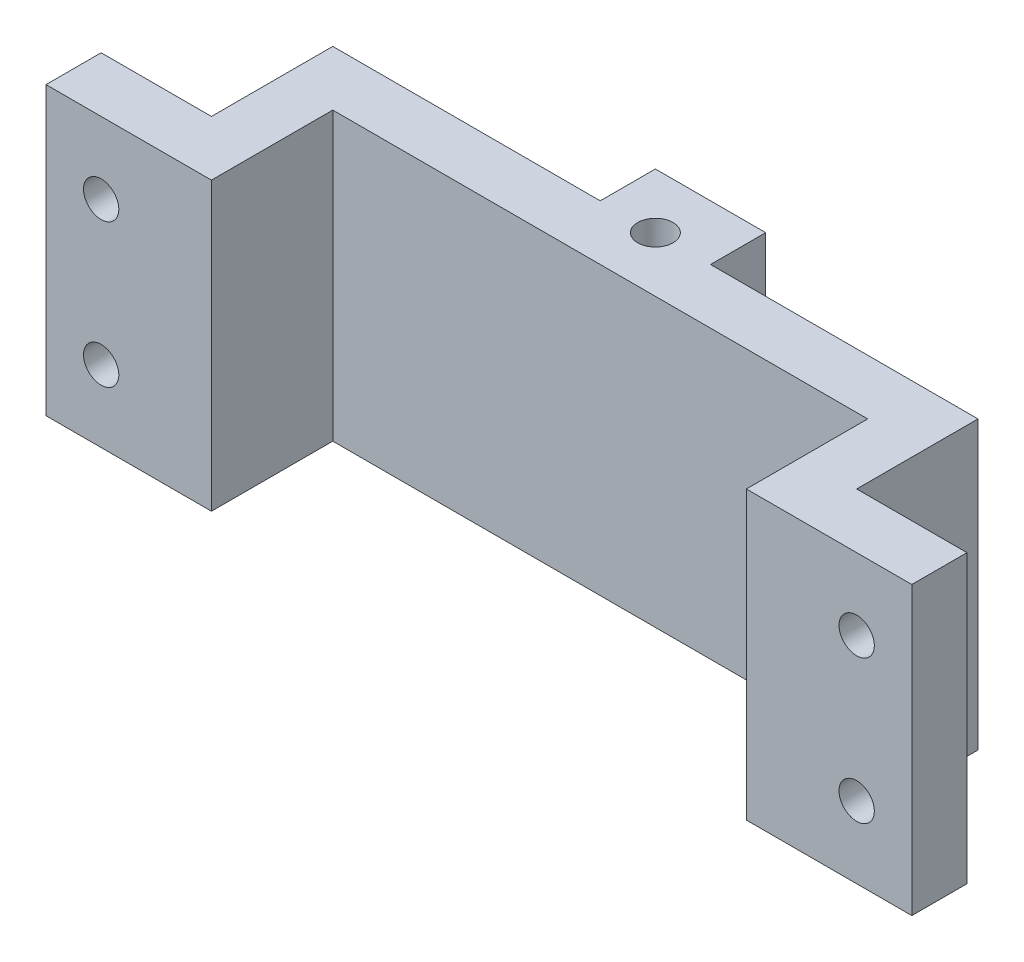
from build123d import *

# Parameters (mm, degrees)
BOSS_EXTRUDE2_DEPTH = 26
SKETCH5_R           = 1.6
CUT_EXTRUDE4_DEPTH  = 26
SKETCH6_R           = 1.6
CUT_EXTRUDE6_DEPTH  = 26


with BuildPart() as part:
    # Sketch1 → Boss-Extrude2 (new body)
    with BuildSketch(Plane(origin=(0, 0, 0), x_dir=(1, 0, 0), z_dir=(0, 1, 0))):
        Polygon((-24.25, 0), (24.25, 0), (24.25, -11), (39.25, -11), (39.25, -6), (29.25, -6), (29.25, 5), (5, 5), (5, 10), (-5, 10), (-5, 5), (-29.25, 5), (-29.25, -6), (-39.25, -6), (-39.25, -11), (-24.25, -11), align=None)
    extrude(amount=BOSS_EXTRUDE2_DEPTH)

    # Sketch5 → Cut-Extrude4 (cut)
    with BuildSketch(Plane.XZ):
        with Locations(Location((0, -5, 0), (0, 0, 270))):
            Circle(SKETCH5_R)
    extrude(amount=-CUT_EXTRUDE4_DEPTH, mode=Mode.SUBTRACT)

    # Sketch6 → Cut-Extrude6 (cut)
    with BuildSketch(Plane(origin=(0, 0, 6), x_dir=(-1, 0, 0), z_dir=(0, 0, -1))):
        with Locations((34.25, 19.5)):
            Circle(SKETCH6_R)
        with Locations((34.25, 6.5)):
            Circle(SKETCH6_R)
        with Locations((-34.25, 6.5)):
            Circle(SKETCH6_R)
        with Locations((-34.25, 19.5)):
            Circle(SKETCH6_R)
    extrude(amount=-CUT_EXTRUDE6_DEPTH, mode=Mode.SUBTRACT)


solid = part.part
